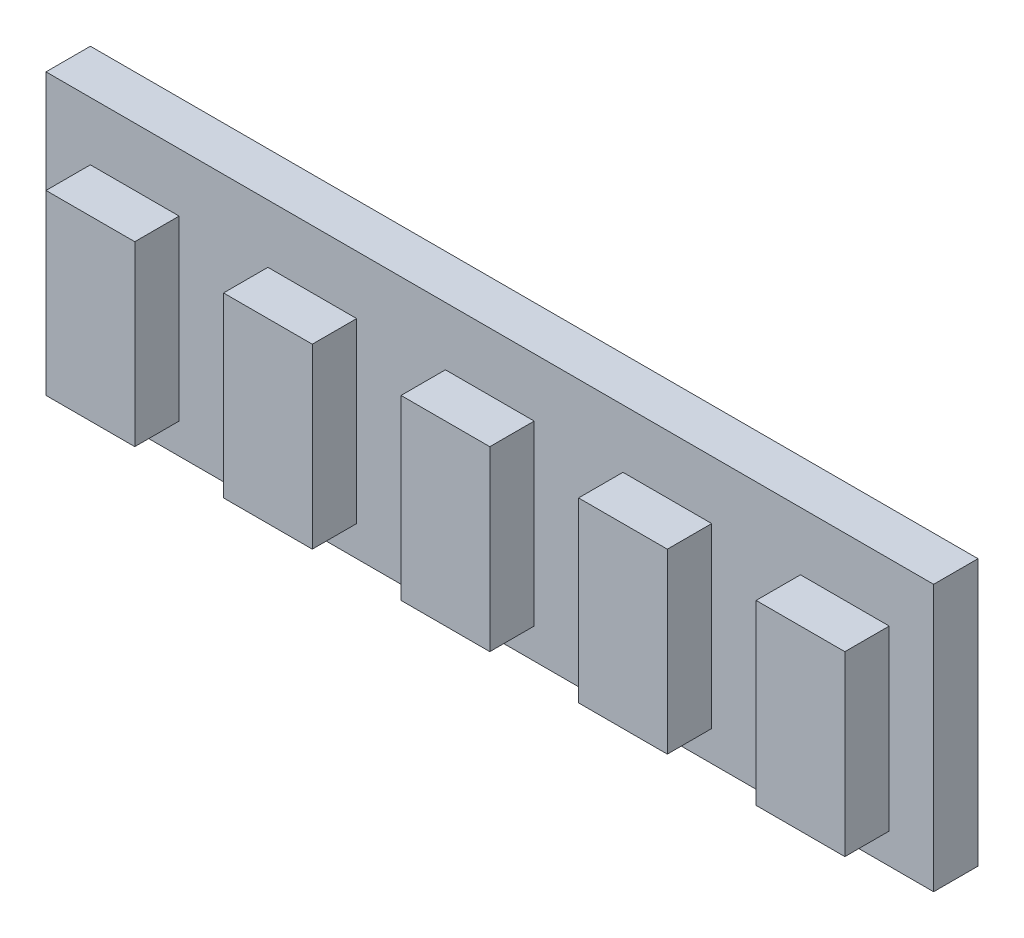
from build123d import *

# Parameters (mm, degrees)
SKETCH1_W           = 100
SKETCH1_H           = 30
BOSS_EXTRUDE1_DEPTH = 5
SKETCH2_W           = 10
SKETCH2_H           = 20
BOSS_EXTRUDE2_DEPTH = 5
LPATTERN1_COUNT     = 5
LPATTERN1_PITCH     = 20


with BuildPart() as part:
    # Sketch1 → Boss-Extrude1 (new body)
    with BuildSketch(Plane.XY):
        with Locations((18.440366972, 3.71559633)):
            Rectangle(SKETCH1_W, SKETCH1_H)
    extrude(amount=BOSS_EXTRUDE1_DEPTH)

    # Sketch2 → Boss-Extrude2 (add)
    with BuildSketch(Plane.XY.offset(5)):
        with Locations((-21.559633028, 2.143304858)):
            Rectangle(SKETCH2_W, SKETCH2_H)
    boss_extrude2 = extrude(amount=BOSS_EXTRUDE2_DEPTH)

    # LPattern1: Boss-Extrude2 ×5
    with Locations(*[(i * LPATTERN1_PITCH, 0, 0) for i in range(1, LPATTERN1_COUNT)]):
        add(boss_extrude2)


solid = part.part
